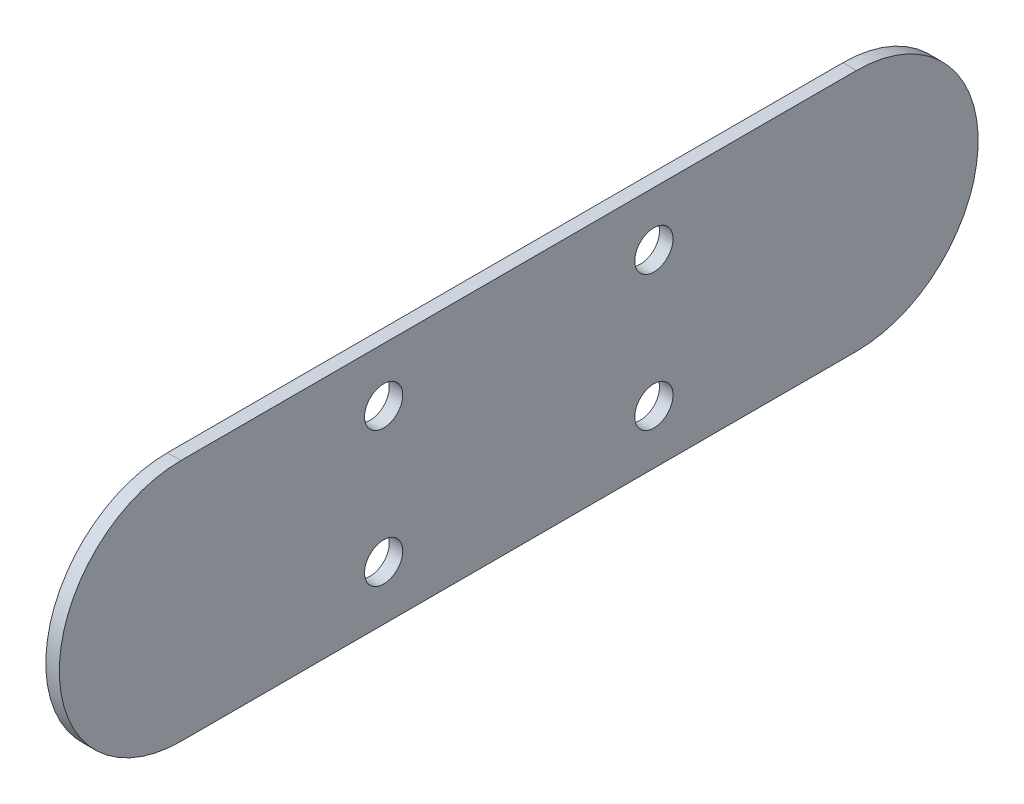
from build123d import *

# Parameters (mm, degrees)
BOSS_EXTRUDE1_DEPTH   = 1.5875
F_8_CLEARANCE_HOLE1_D = 4.4958


with BuildPart() as part:
    # Sketch2 → Boss-Extrude1 (new body)
    with BuildSketch(Plane(origin=(0, 0, 0), x_dir=(0, 0, -1), z_dir=(1, 0, 0))):
        with BuildLine():
            Line((39.6875, -14.2875), (-39.6875, -14.2875))
            ThreePointArc((-39.6875, -14.2875), (-53.975, 0), (-39.6875, 14.2875))
            Line((-39.6875, 14.2875), (39.6875, 14.2875))
            ThreePointArc((39.6875, 14.2875), (53.975, 0), (39.6875, -14.2875))
        make_face()
    extrude(amount=BOSS_EXTRUDE1_DEPTH)

    # #8 Clearance Hole1 (through all)
    with Locations(Plane(origin=(1.5875, 0, 0), x_dir=(0, 0, -1), z_dir=(1, 0, 0))):
        with Locations((-15.875, 7.9375), (-15.875, -7.9375), (15.875, -7.9375), (15.875, 7.9375)):
            Hole(F_8_CLEARANCE_HOLE1_D / 2)


solid = part.part
